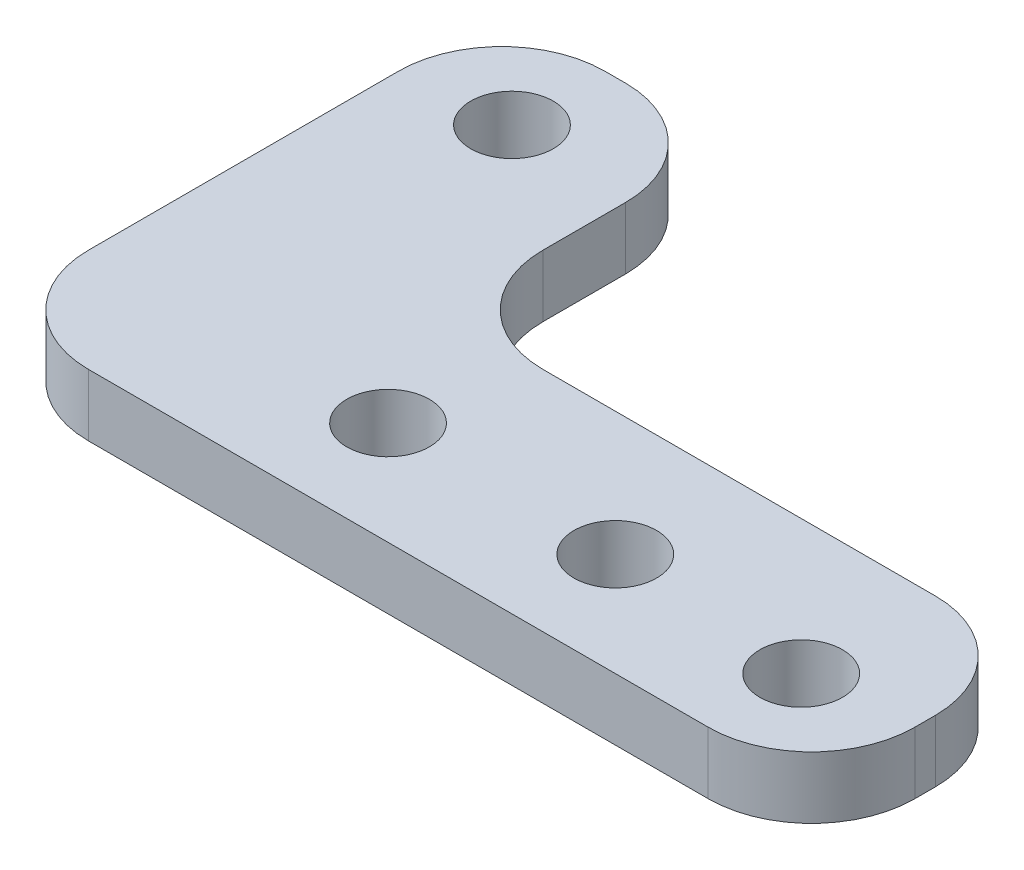
from build123d import *

# Parameters (mm, degrees)
SKETCH1_W                = 40
SKETCH1_H                = 25
BOSS_EXTRUDE1_DEPTH      = 3
F_4_0_4_DIAMETER_HOLE1_D = 4
F_4_0_4_DIAMETER_HOLE2_D = 4
SKETCH10_W               = 29
SKETCH10_H               = 14
CUT_EXTRUDE2_DEPTH       = 3
FILLET2_R                = 5


with BuildPart() as part:
    # Sketch1 → Boss-Extrude1 (new body)
    with BuildSketch(Plane(origin=(0, 0, 0), x_dir=(1, 0, 0), z_dir=(0, 1, 0))):
        Rectangle(SKETCH1_W, SKETCH1_H)
    extrude(amount=BOSS_EXTRUDE1_DEPTH)

    # Ø4.0 (4) Diameter Hole1 (through all)
    with Locations(Plane(origin=(0, 3, 0), x_dir=(1, 0, 0), z_dir=(0, 1, 0))):
        with Locations((-15, 8), (15, -8)):
            Hole(F_4_0_4_DIAMETER_HOLE1_D / 2)

    # Ø4.0 (4) Diameter Hole2 (through all)
    with Locations(Plane(origin=(0, 3, 0), x_dir=(1, 0, 0), z_dir=(0, 1, 0))):
        with Locations((-5.5, -7.5), (5.5, -7.5)):
            Hole(F_4_0_4_DIAMETER_HOLE2_D / 2)

    # Sketch10 → Cut-Extrude2 (cut)
    with BuildSketch(Plane(origin=(0, 3, 0), x_dir=(1, 0, 0), z_dir=(0, 1, 0))):
        with Locations((5.5, 5.5)):
            Rectangle(SKETCH10_W, SKETCH10_H)
    extrude(amount=-CUT_EXTRUDE2_DEPTH, mode=Mode.SUBTRACT)

    # Fillet2
    fillet2_edges = [part.edges().sort_by_distance(p)[0] for p in [
        (-9, 1.5, -12.5),
        (20, 1.5, 1.5),
        (-9, 1.5, 1.5),
        (-20, 1.5, -12.5),
        (20, 1.5, 12.5),
        (-20, 1.5, 12.5),
    ]]
    fillet(fillet2_edges, radius=FILLET2_R)


solid = part.part
